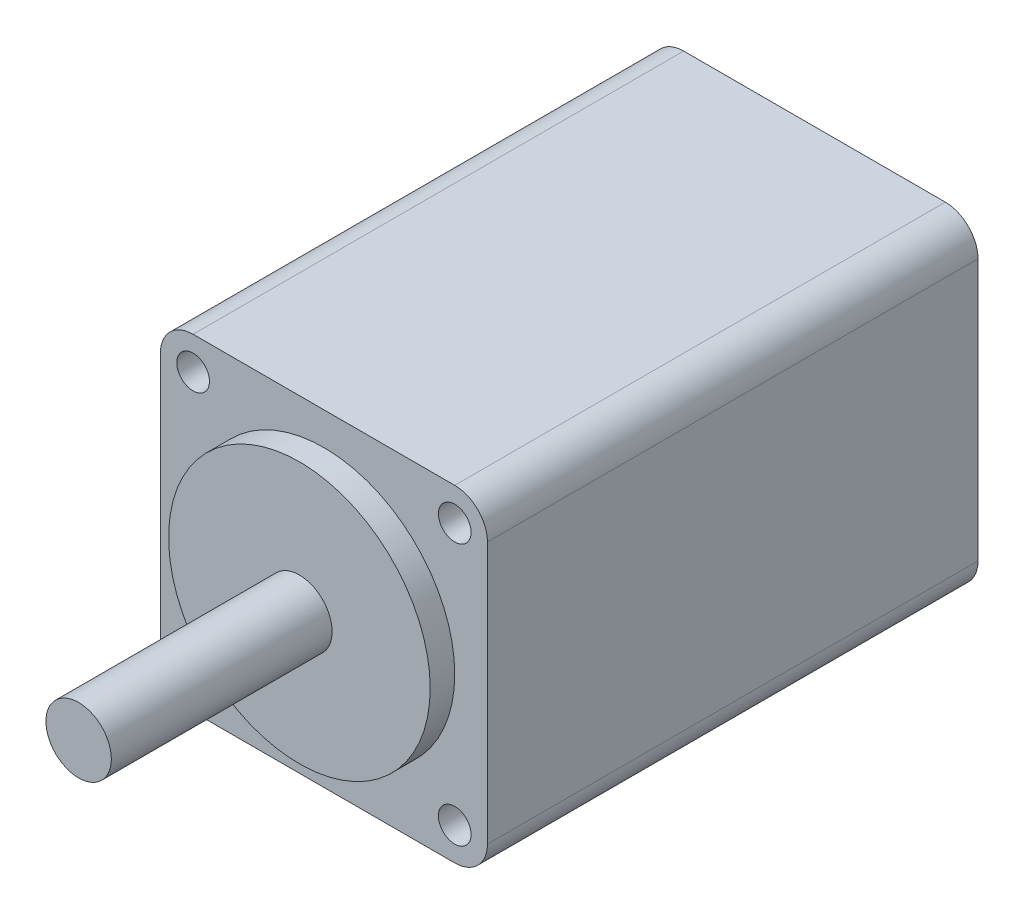
from build123d import *

# Parameters (mm, degrees)
SKETCH1_W           = 20
SKETCH1_H           = 20
BOSS_EXTRUDE1_DEPTH = 30
SKETCH2_R           = 1
CUT_EXTRUDE1_DEPTH  = 6
FILLET1_R           = 2
SKETCH3_R           = 8
BOSS_EXTRUDE2_DEPTH = 1.5
SKETCH4_R           = 2
BOSS_EXTRUDE3_DEPTH = 13.5


with BuildPart() as part:
    # Sketch1 → Boss-Extrude1 (new body)
    with BuildSketch(Plane.XY):
        Rectangle(SKETCH1_W, SKETCH1_H)
    extrude(amount=-BOSS_EXTRUDE1_DEPTH)

    # Sketch2 → Cut-Extrude1 (cut)
    with BuildSketch(Plane.XY):
        with Locations((-8, 8)):
            Circle(SKETCH2_R)
        with Locations((8, 8)):
            Circle(SKETCH2_R)
        with Locations((8, -8)):
            Circle(SKETCH2_R)
        with Locations((-8, -8)):
            Circle(SKETCH2_R)
    extrude(amount=-CUT_EXTRUDE1_DEPTH, mode=Mode.SUBTRACT)

    # Fillet1
    fillet1_edges = [part.edges().sort_by_distance(p)[0] for p in [
        (10, -10, -15),
        (-10, -10, -15),
        (-10, 10, -15),
        (10, 10, -15),
    ]]
    fillet(fillet1_edges, radius=FILLET1_R)

    # Sketch3 → Boss-Extrude2 (add)
    with BuildSketch(Plane.XY):
        Circle(SKETCH3_R)
    extrude(amount=BOSS_EXTRUDE2_DEPTH)

    # Sketch4 → Boss-Extrude3 (add)
    with BuildSketch(Plane.XY.offset(1.5)):
        Circle(SKETCH4_R)
    extrude(amount=BOSS_EXTRUDE3_DEPTH)


solid = part.part
